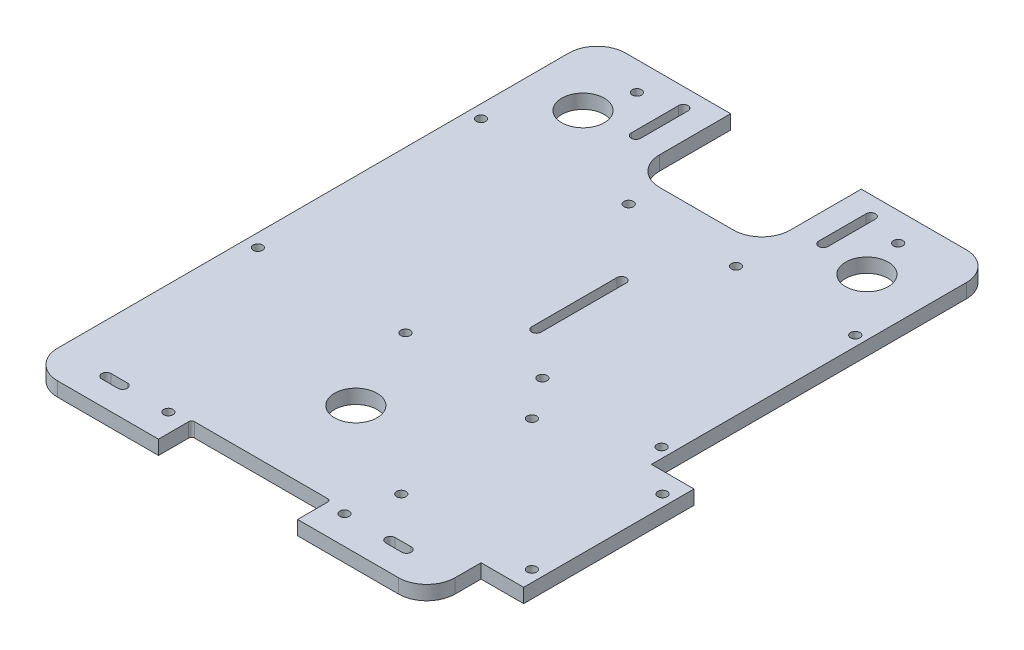
from build123d import *

# Parameters (mm, degrees)
SKETCH_1_R          = 1.65
SKETCH_1_R_2        = 7.5
EXTRUDE_1_DEPTH     = 5
CUT_EXTRUDE_1_DEPTH = 5
CUT_EXTRUDE_3_DEPTH = 5


with BuildPart() as part:
    # 草图1 → 凸台-拉伸1 (new body)
    with BuildSketch(Plane(origin=(0, 0, 0), x_dir=(1, 0, 0), z_dir=(0, 1, 0))):
        with BuildLine():
            Line((120, 0), (125, 0))
            ThreePointArc((125, 0), (132.071067812, -2.928932188), (135, -10))
            Line((135, -10), (135, -120.9))
            Line((135, -120.9), (150, -120.9))
            Line((150, -120.9), (150, -180.9))
            Line((150, -180.9), (135, -180.9))
            Line((135, -180.9), (135, -190))
            ThreePointArc((135, -190), (132.071067812, -197.071067812), (125, -200))
            Line((125, -200), (89.5, -200))
            Line((89.5, -200), (89.5, -189.35))
            ThreePointArc((89.5, -189.35), (89.207106781, -188.642893219), (88.5, -188.35))
            Line((88.5, -188.35), (41.5, -188.35))
            ThreePointArc((41.5, -188.35), (40.792893219, -188.642893219), (40.5, -189.35))
            Line((40.5, -189.35), (40.5, -200))
            Line((40.5, -200), (5, -200))
            ThreePointArc((5, -200), (-2.071067812, -197.071067812), (-5, -190))
            Line((-5, -190), (-5, -10))
            ThreePointArc((-5, -10), (-2.071067812, -2.928932188), (5, 0))
            Line((5, 0), (10, 0))
            Line((10, 0), (120, 0))
        make_face()
        with Locations(Location((19, -10, 0), (0, 0, 270))):
            Circle(SKETCH_1_R, mode=Mode.SUBTRACT)
        with Locations(Location((111, -10, 0), (0, 0, 270))):
            Circle(SKETCH_1_R, mode=Mode.SUBTRACT)
        with Locations(Location((15, -25, 0), (0, 0, 270))):
            Circle(SKETCH_1_R_2, mode=Mode.SUBTRACT)
        with Locations(Location((115, -25, 0), (0, 0, 90))):
            Circle(SKETCH_1_R_2, mode=Mode.SUBTRACT)
        with Locations(Location((-0.4, -45.5, 0), (0, 0, 270))):
            Circle(SKETCH_1_R, mode=Mode.SUBTRACT)
        with Locations(Location((51.6, -45.5, 0), (0, 0, 270))):
            Circle(SKETCH_1_R, mode=Mode.SUBTRACT)
        with Locations(Location((51.6, -124.1, 0), (0, 0, 270))):
            Circle(SKETCH_1_R, mode=Mode.SUBTRACT)
        with Locations(Location((-0.4, -124.1, 0), (0, 0, 270))):
            Circle(SKETCH_1_R, mode=Mode.SUBTRACT)
        with Locations(Location((89.5, -45.6, 0), (0, 0, 270))):
            Circle(SKETCH_1_R, mode=Mode.SUBTRACT)
        with Locations(Location((131.5, -45.6, 0), (0, 0, 270))):
            Circle(SKETCH_1_R, mode=Mode.SUBTRACT)
        with Locations(Location((131.5, -113.8, 0), (0, 0, 270))):
            Circle(SKETCH_1_R, mode=Mode.SUBTRACT)
        with Locations(Location((89.5, -113.8, 0), (0, 0, 270))):
            Circle(SKETCH_1_R, mode=Mode.SUBTRACT)
        with Locations(Location((146, -128, 0), (0, 0, 270))):
            Circle(SKETCH_1_R, mode=Mode.SUBTRACT)
        with Locations(Location((100, -128, 0), (0, 0, 270))):
            Circle(SKETCH_1_R, mode=Mode.SUBTRACT)
        with Locations(Location((100, -174, 0), (0, 0, 270))):
            Circle(SKETCH_1_R, mode=Mode.SUBTRACT)
        with Locations(Location((146, -174, 0), (0, 0, 270))):
            Circle(SKETCH_1_R, mode=Mode.SUBTRACT)
        with Locations(Location((65, -155, 0), (0, 0, 270))):
            Circle(SKETCH_1_R_2, mode=Mode.SUBTRACT)
        with Locations(Location((96, -190, 0), (0, 0, 270))):
            Circle(SKETCH_1_R, mode=Mode.SUBTRACT)
        with Locations(Location((34, -190, 0), (0, 0, 90))):
            Circle(SKETCH_1_R, mode=Mode.SUBTRACT)
        with BuildLine():
            Line((96.35, -23.35), (96.35, -6.65))
            ThreePointArc((96.35, -6.65), (98, -5), (99.65, -6.65))
            Line((99.65, -6.65), (99.65, -23.35))
            ThreePointArc((99.65, -23.35), (98, -25), (96.35, -23.35))
        make_face(mode=Mode.SUBTRACT)
        with BuildLine():
            Line((30.35, -6.65), (30.35, -23.35))
            ThreePointArc((30.35, -23.35), (32, -25), (33.65, -23.35))
            Line((33.65, -23.35), (33.65, -6.65))
            ThreePointArc((33.65, -6.65), (32, -5), (30.35, -6.65))
        make_face(mode=Mode.SUBTRACT)
        with BuildLine():
            Line((17.85, -188.35), (12.15, -188.35))
            ThreePointArc((12.15, -188.35), (10.983273811, -188.833273811), (10.5, -190))
            ThreePointArc((10.5, -190), (10.983273811, -191.166726189), (12.15, -191.65))
            Line((12.15, -191.65), (17.85, -191.65))
            ThreePointArc((17.85, -191.65), (19.016726189, -191.166726189), (19.5, -190))
            ThreePointArc((19.5, -190), (19.016726189, -188.833273811), (17.85, -188.35))
        make_face(mode=Mode.SUBTRACT)
        with BuildLine():
            Line((112.15, -188.35), (117.85, -188.35))
            ThreePointArc((117.85, -188.35), (119.016726189, -188.833273811), (119.5, -190))
            ThreePointArc((119.5, -190), (119.016726189, -191.166726189), (117.85, -191.65))
            Line((117.85, -191.65), (112.15, -191.65))
            ThreePointArc((112.15, -191.65), (110.983273811, -191.166726189), (110.5, -190))
            ThreePointArc((110.5, -190), (110.983273811, -188.833273811), (112.15, -188.35))
        make_face(mode=Mode.SUBTRACT)
    extrude(amount=EXTRUDE_1_DEPTH)

    # 草图2 → 切除-拉伸1 (cut)
    with BuildSketch(Plane.XZ):
        with BuildLine():
            Line((42, 0), (88, 0))
            Line((88, 0), (88, 25))
            ThreePointArc((88, 25), (85.071067812, 32.071067812), (78, 35))
            Line((78, 35), (52, 35))
            ThreePointArc((52, 35), (44.928932188, 32.071067812), (42, 25))
            Line((42, 25), (42, 0))
        make_face()
    extrude(amount=-CUT_EXTRUDE_1_DEPTH, mode=Mode.SUBTRACT)

    # 草图4 → 切除-拉伸3 (cut)
    with BuildSketch(Plane(origin=(0, 0, 0), x_dir=(1, 0, 0), z_dir=(0, 1, 0))):
        with BuildLine():
            Line((75.25, -70), (75.25, -100))
            ThreePointArc((75.25, -100), (73.6, -101.65), (71.95, -100))
            Line((71.95, -100), (71.95, -70))
            ThreePointArc((71.95, -70), (73.6, -68.35), (75.25, -70))
        make_face()
    extrude(amount=CUT_EXTRUDE_3_DEPTH, mode=Mode.SUBTRACT)


solid = part.part
